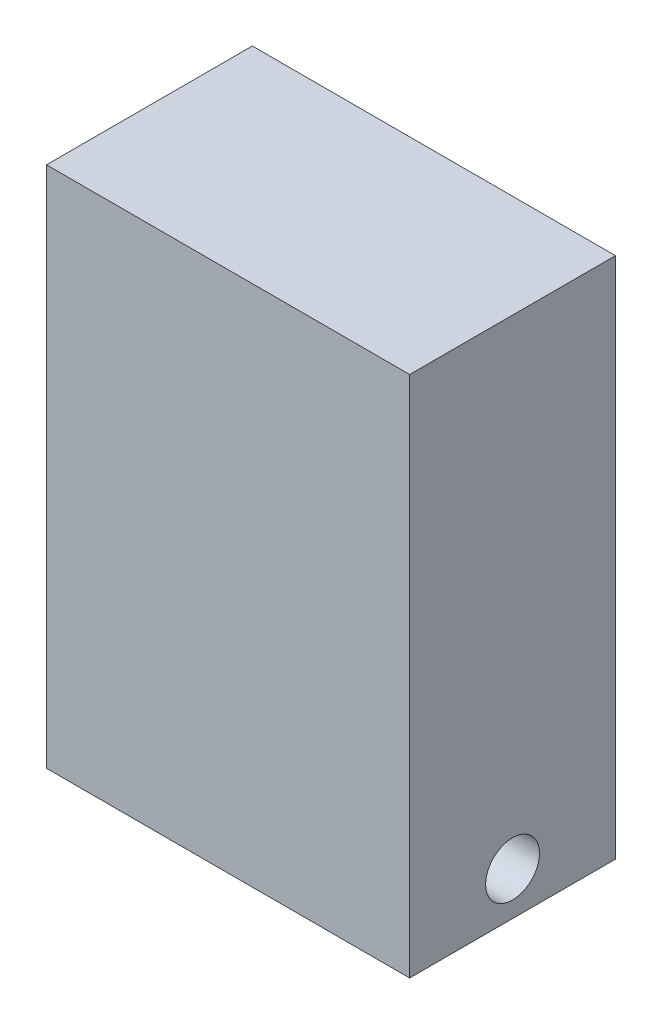
from build123d import *

# Parameters (mm, degrees)
SKETCH2_W               = 85.598
SKETCH2_H               = 123.19
BOSS_EXTRUDE1_DEPTH     = 48.514
CUT_EXTRUDE1_DEPTH      = 158.659131991
CUT_EXTRUDE1_DEPTH_BACK = 158.659131991
SKETCH3_R               = 6.35


with BuildPart() as part:
    # Sketch2 → Boss-Extrude1 (new body)
    with BuildSketch(Plane.XY):
        with Locations((42.799, 61.595)):
            Rectangle(SKETCH2_W, SKETCH2_H)
    extrude(amount=BOSS_EXTRUDE1_DEPTH)

    # Sketch3 → Cut-Extrude1 (cut, two sides: drawn at the far end of the back side and taken through both)
    with BuildSketch(Plane.ZY.offset(-CUT_EXTRUDE1_DEPTH_BACK)):
        with Locations((24.257, 10.16)):
            Circle(SKETCH3_R)
    extrude(amount=CUT_EXTRUDE1_DEPTH + CUT_EXTRUDE1_DEPTH_BACK, mode=Mode.SUBTRACT)


solid = part.part
